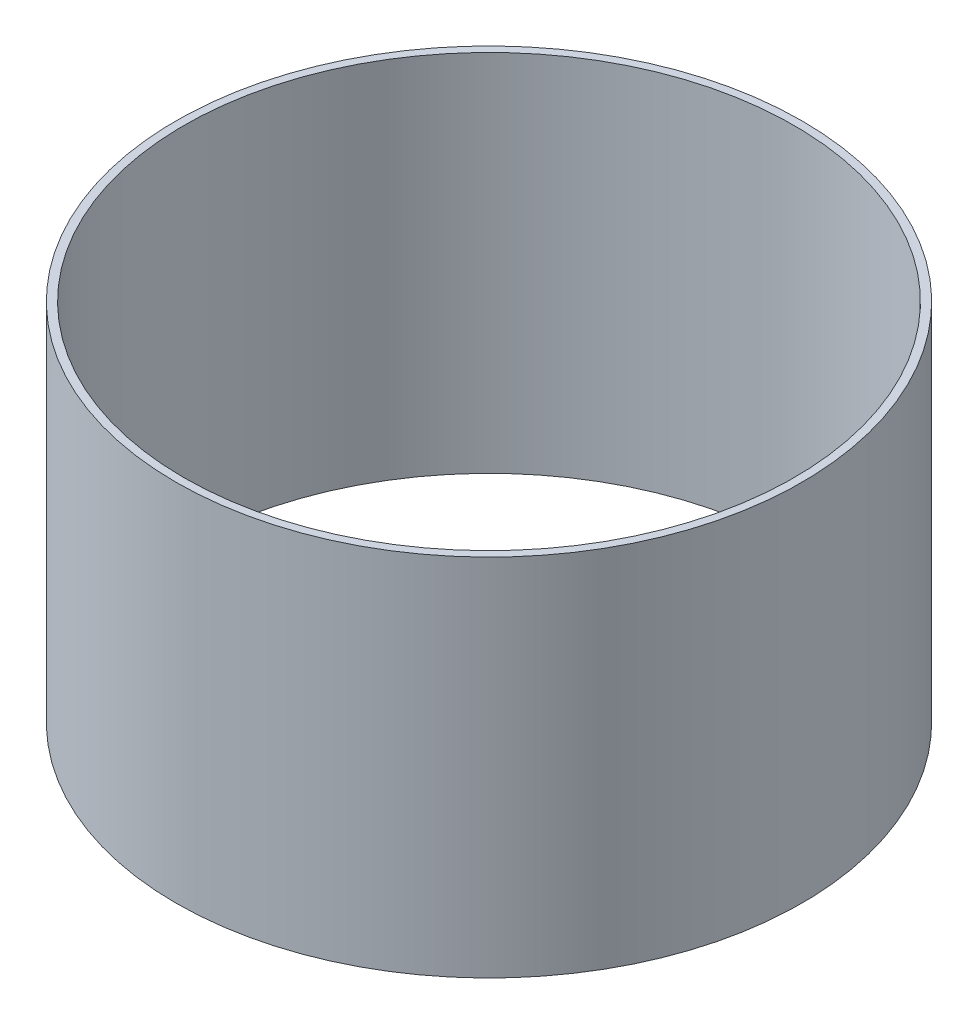
from build123d import *

# Parameters (mm, degrees)
SKETCH1_R           = 79
SKETCH1_R_2         = 77
BOSS_EXTRUDE1_DEPTH = 92


with BuildPart() as part:
    # Sketch1 → Boss-Extrude1 (new body)
    with BuildSketch(Plane(origin=(0, 0, 0), x_dir=(1, 0, 0), z_dir=(0, 1, 0))):
        with Locations(Location((0, 0, 0), (0, 0, 270))):
            Circle(SKETCH1_R)
        with Locations(Location((0, 0, 0), (0, 0, 270))):
            Circle(SKETCH1_R_2, mode=Mode.SUBTRACT)
    extrude(amount=BOSS_EXTRUDE1_DEPTH)


solid = part.part
